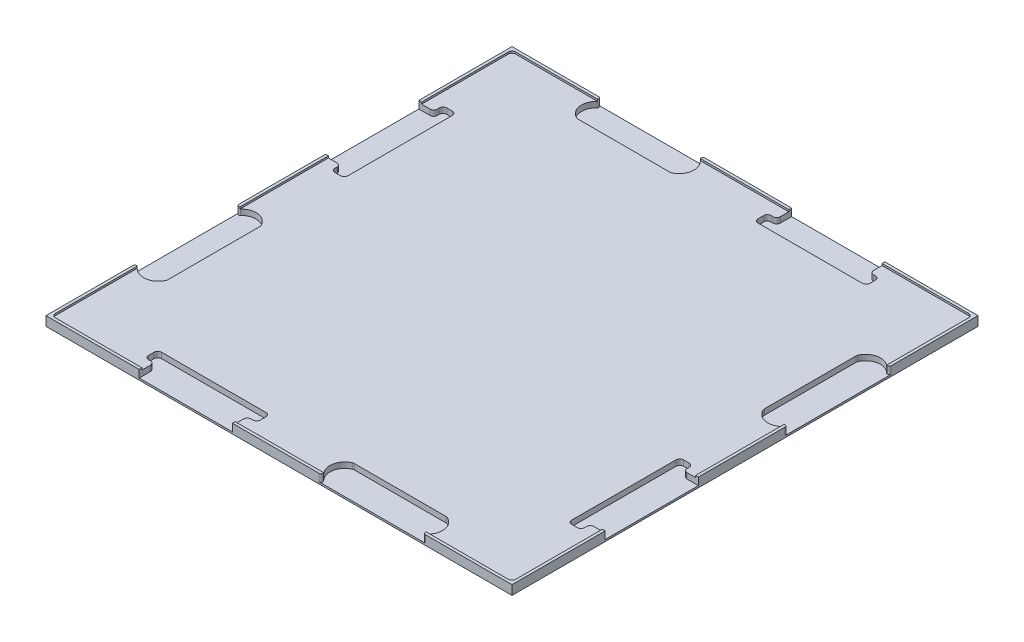
from build123d import *

# Parameters (mm, degrees)
SKETCH1_W           = 250
SKETCH1_H           = 250
BOSS_EXTRUDE1_DEPTH = 2.5
SKETCH2_W           = 247
SKETCH2_H           = 247
CUT_EXTRUDE1_DEPTH  = 1
CUT_EXTRUDE4_DEPTH  = 4
CIRPATTERN1_COUNT   = 4
FILLET2_R           = 2
FILLET3_R           = 1


with BuildPart() as part:
    # Sketch1 → Boss-Extrude1 (new, symmetric)
    with BuildSketch(Plane(origin=(0, 0, 0), x_dir=(1, 0, 0), z_dir=(0, 1, 0))):
        Rectangle(SKETCH1_W, SKETCH1_H)
    extrude(amount=BOSS_EXTRUDE1_DEPTH, both=True)

    # Sketch2 → Cut-Extrude1 (cut)
    with BuildSketch(Plane(origin=(0, 2.5, 0), x_dir=(1, 0, 0), z_dir=(0, 1, 0))):
        Rectangle(SKETCH2_W, SKETCH2_H)
    extrude(amount=-CUT_EXTRUDE1_DEPTH, mode=Mode.SUBTRACT)

    # Sketch5 → Cut-Extrude4 (cut)
    with BuildSketch(Plane(origin=(0, 2.5, 0), x_dir=(1, 0, 0), z_dir=(0, 1, 0))):
        Polygon((-75, -125), (-75, -117), (-80, -117), (-80, -110), (-20, -110), (-20, -117), (-25, -117), (-25, -125), align=None)
        with BuildLine():
            Line((25, -125), (75, -125))
            ThreePointArc((75, -125), (80.216117819, -117.5), (75, -110))
            Line((75, -110), (25, -110))
            ThreePointArc((25, -110), (19.783882181, -117.5), (25, -125))
        make_face()
    cut_extrude4 = extrude(amount=-CUT_EXTRUDE4_DEPTH, mode=Mode.SUBTRACT)

    # CirPattern1: Cut-Extrude4 ×4 about axis
    cirpattern1_axis = Axis((0, -36.47073331, 0), (0, 1, 0))
    for i in range(1, CIRPATTERN1_COUNT):
        add(cut_extrude4.rotate(cirpattern1_axis, i * 360 / CIRPATTERN1_COUNT), mode=Mode.SUBTRACT)

    # Fillet2
    fillet2_edges = [part.edges().sort_by_distance(p)[0] for p in [
        (-117, 0, -25),
        (-117, 0, -20),
        (-110, 0, -20),
        (-110, 0, -80),
        (-117, 0, -80),
        (-123.5, 2, -123.5),
        (-75, 0, -110),
        (-25, 0, -110),
        (25, 0, -117),
        (20, 0, -117),
        (20, 0, -110),
        (80, 0, -110),
        (80, 0, -117),
        (75, 0, -117),
        (123.5, 2, -123.5),
        (110, 0, -75),
        (110, 0, -25),
        (117, 0, 25),
        (117, 0, 20),
        (110, 0, 20),
        (110, 0, 80),
        (117, 0, 80),
        (117, 0, 75),
        (123.5, 2, 123.5),
        (75, 0, 110),
        (25, 0, 110),
        (-25, 0, 117),
        (-20, 0, 117),
        (-20, 0, 110),
        (-80, 0, 110),
        (-80, 0, 117),
        (-75, 0, 117),
        (-123.5, 2, 123.5),
        (-110, 0, 75),
        (-110, 0, 25),
        (-117, 0, -75),
    ]]
    fillet(fillet2_edges, radius=FILLET2_R)

    # Fillet3
    fillet3_edges = [part.edges().sort_by_distance(p)[0] for p in [
        (-75, 0.5, -125),
        (-25, 0.5, -125),
        (125, 0.5, -25),
        (125, 0.5, -75),
        (25, 0.5, 125),
        (75, 0.5, 125),
        (-125, 0.5, 75),
        (-125, 0.5, 25),
    ]]
    fillet(fillet3_edges, radius=FILLET3_R)


solid = part.part
